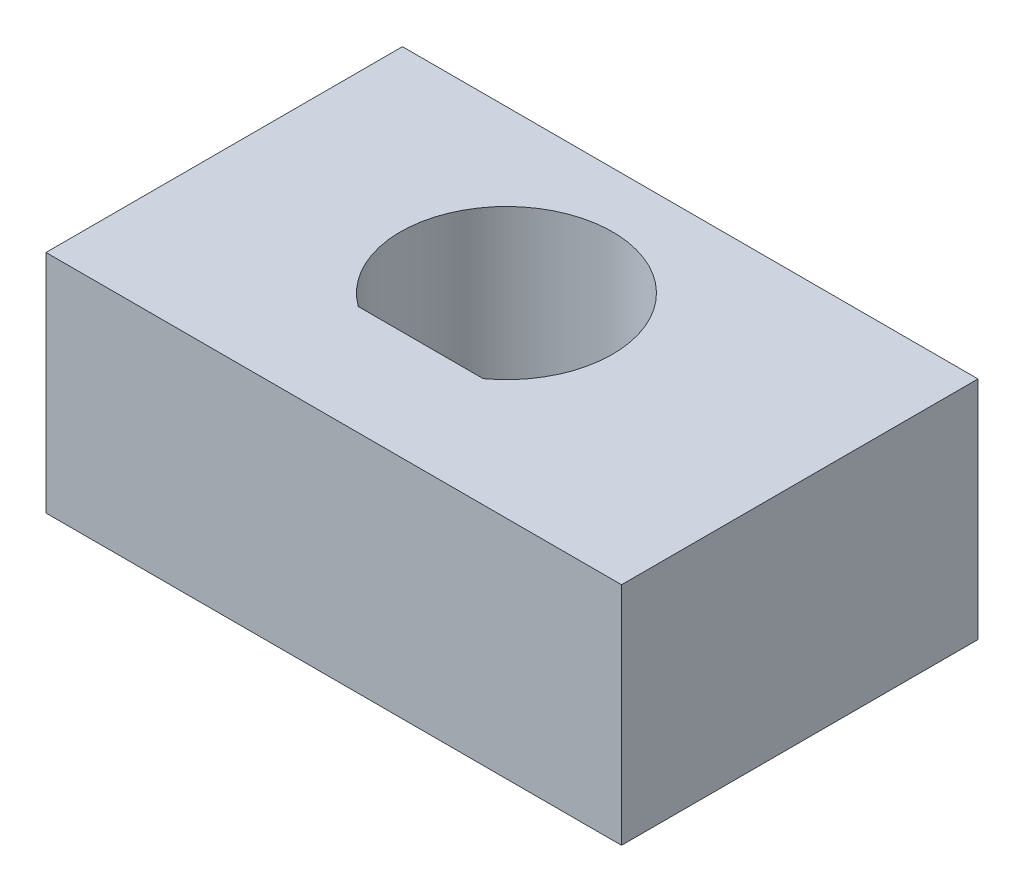
from build123d import *

# Parameters (mm, degrees)
SKETCH1_W           = 25.499374977
SKETCH1_H           = 15.79332804
BOSS_EXTRUDE1_DEPTH = 10


with BuildPart() as part:
    # Sketch1 → Boss-Extrude1 (new body)
    with BuildSketch(Plane(origin=(0, 0, 0), x_dir=(1, 0, 0), z_dir=(0, 1, 0))):
        with Locations((0.990737135, -0.745657883)):
            Rectangle(SKETCH1_W, SKETCH1_H)
        with BuildLine():
            Line((-2.765863337, -3.8), (2.765863337, -3.8))
            ThreePointArc((2.765863337, -3.8), (0, 4.7), (-2.765863337, -3.8))
        make_face(mode=Mode.SUBTRACT)
    extrude(amount=BOSS_EXTRUDE1_DEPTH)


solid = part.part
